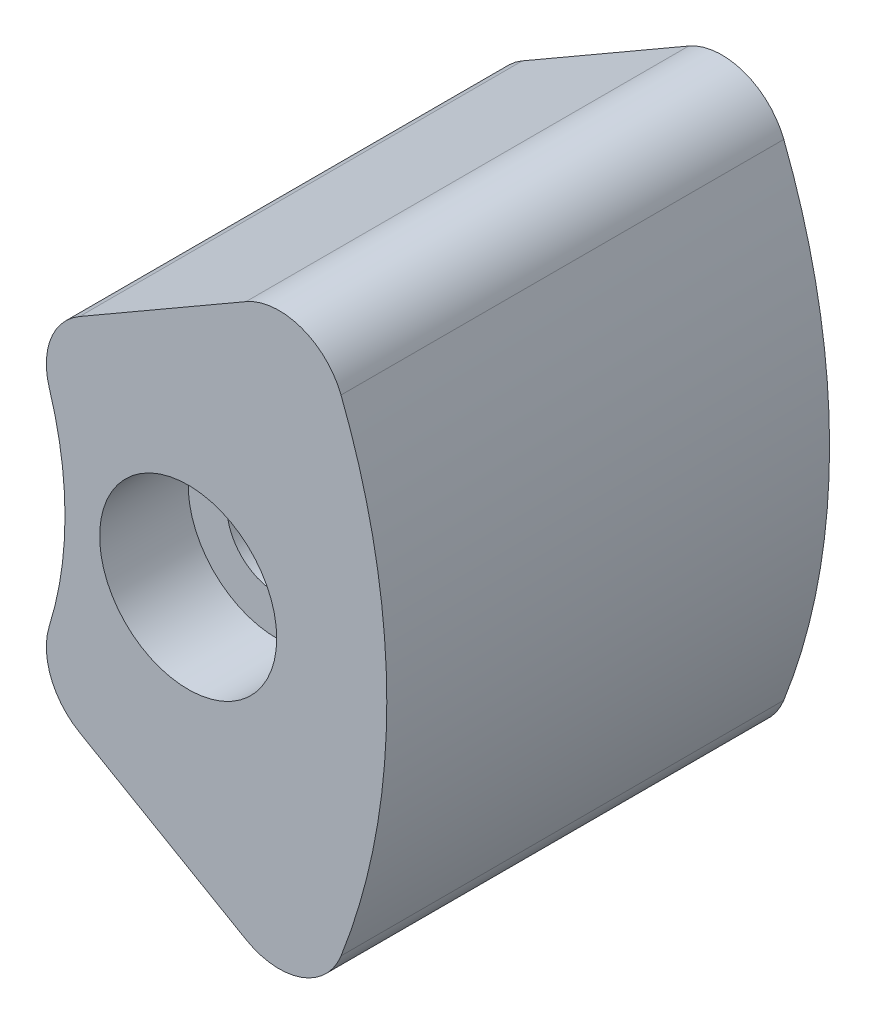
from build123d import *

# Parameters (mm, degrees)
RESSALTO_EXTRUS_O1_DEPTH          = 20
REBAIXO_PARA_SHCS_M41_D           = 4.5
REBAIXO_PARA_SHCS_M41_CBORE_D     = 8
REBAIXO_PARA_SHCS_M41_CBORE_DEPTH = 4


with BuildPart() as part:
    # Esboço1 → Ressalto-extrusão1 (new body)
    with BuildSketch(Plane.XY):
        with BuildLine():
            Line((224.973932781, 108.136324985), (232.491448563, 112.476564746))
            ThreePointArc((232.491448563, 112.476564746), (234.984464913, 112.709375061), (236.785753669, 110.970211474))
            ThreePointArc((236.785753669, 110.970211474), (238.85268513, 100), (236.785753669, 89.029788526))
            ThreePointArc((236.785753669, 89.029788526), (234.984464913, 87.290624939), (232.491448563, 87.523435254))
            Line((232.491448563, 87.523435254), (224.973932781, 91.863675015))
            ThreePointArc((224.973932781, 91.863675015), (223.679685252, 93.369880929), (223.609856165, 95.354536271))
            ThreePointArc((223.609856165, 95.354536271), (224.317111682, 100), (223.609856165, 104.645463729))
            ThreePointArc((223.609856165, 104.645463729), (223.679685252, 106.630119071), (224.973932781, 108.136324985))
        make_face()
    extrude(amount=RESSALTO_EXTRUS_O1_DEPTH)

    # Rebaixo para SHCS M41 (through all)
    with Locations(Plane.XY.offset(20)):
        with Locations((229.88140452, 100)):
            CounterBoreHole(REBAIXO_PARA_SHCS_M41_D / 2, REBAIXO_PARA_SHCS_M41_CBORE_D / 2, REBAIXO_PARA_SHCS_M41_CBORE_DEPTH)


solid = part.part
